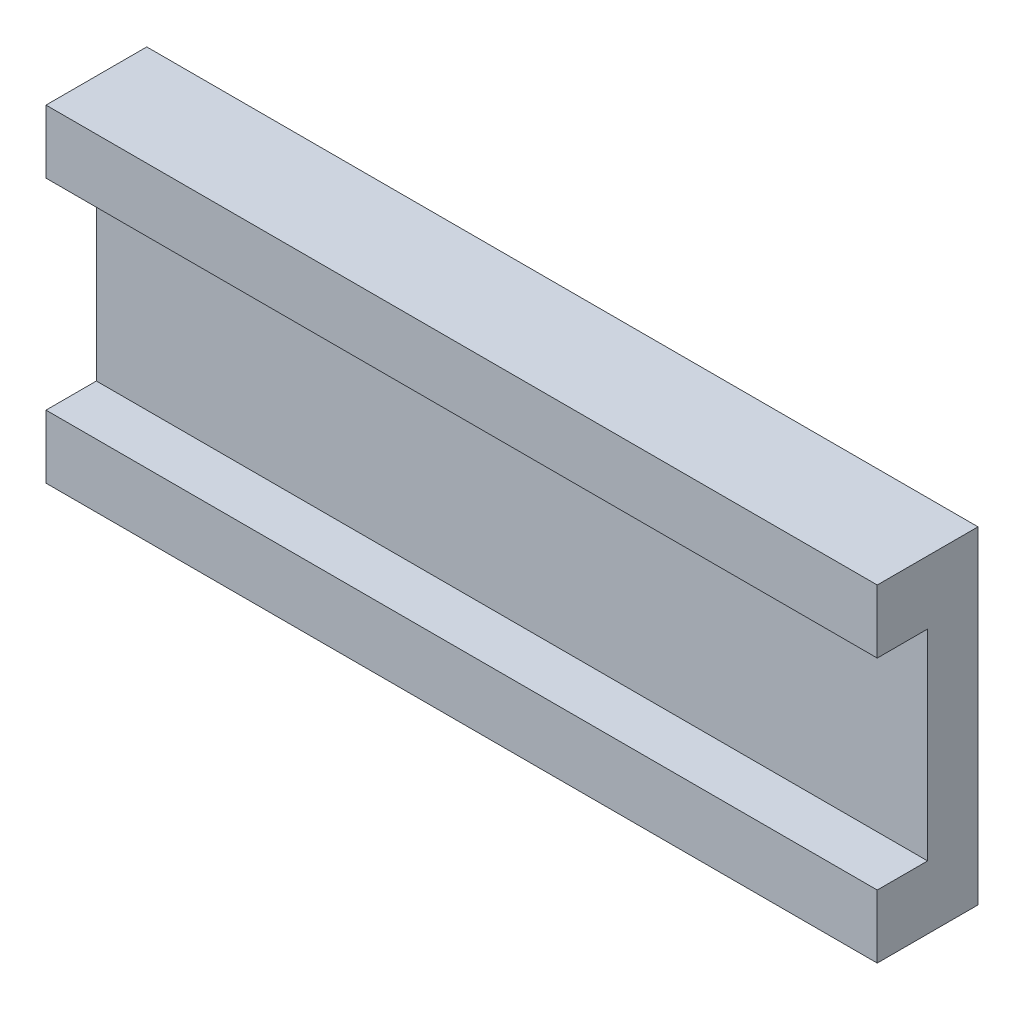
from build123d import *

# Parameters (mm, degrees)
SKETCH1_W           = 83.82
SKETCH1_H           = 33.02
BOSS_EXTRUDE1_DEPTH = 5.08
SKETCH3_W           = 83.82
SKETCH3_H           = 6.382242488
BOSS_EXTRUDE2_DEPTH = 5.08


with BuildPart() as part:
    # Sketch1 → Boss-Extrude1 (new body)
    with BuildSketch(Plane.XY):
        Rectangle(SKETCH1_W, SKETCH1_H)
    extrude(amount=BOSS_EXTRUDE1_DEPTH)

    # Sketch3 → Boss-Extrude2 (add)
    with BuildSketch(Plane.XY.offset(5.08)):
        with Locations((0, 13.318878756)):
            Rectangle(SKETCH3_W, SKETCH3_H)
        with Locations((0, -13.318878756)):
            Rectangle(SKETCH3_W, SKETCH3_H)
    extrude(amount=BOSS_EXTRUDE2_DEPTH)


solid = part.part
